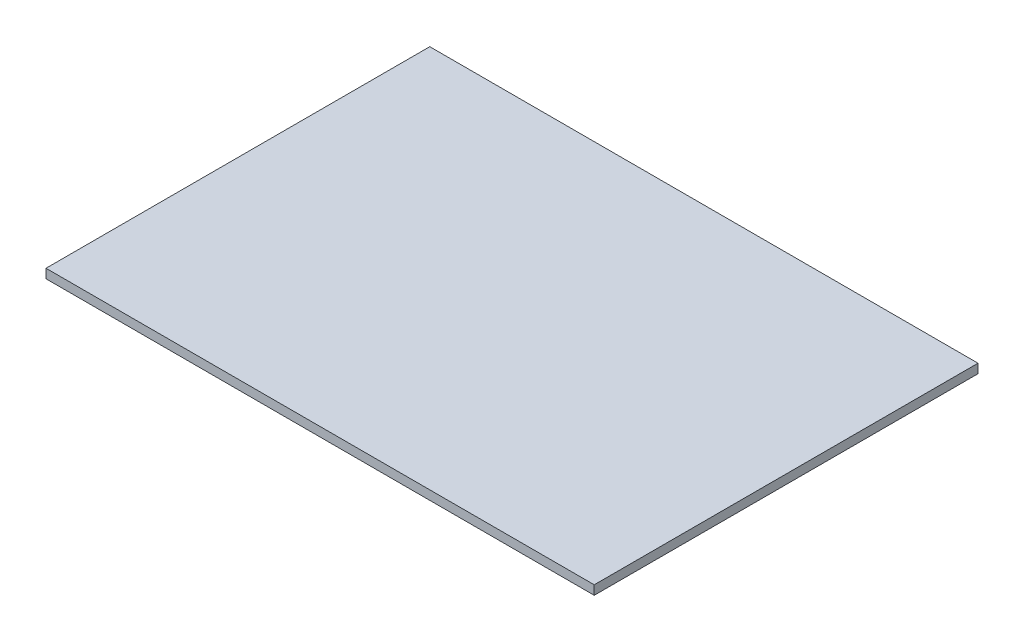
from build123d import *

# Parameters (mm, degrees)
SKETCH1_W           = 762
SKETCH1_H           = 533.4
BOSS_EXTRUDE1_DEPTH = 12.7


with BuildPart() as part:
    # Sketch1 → Boss-Extrude1 (new body)
    with BuildSketch(Plane(origin=(0, 0, 0), x_dir=(1, 0, 0), z_dir=(0, 1, 0))):
        with Locations((381, 266.7)):
            Rectangle(SKETCH1_W, SKETCH1_H)
    extrude(amount=BOSS_EXTRUDE1_DEPTH)


solid = part.part
